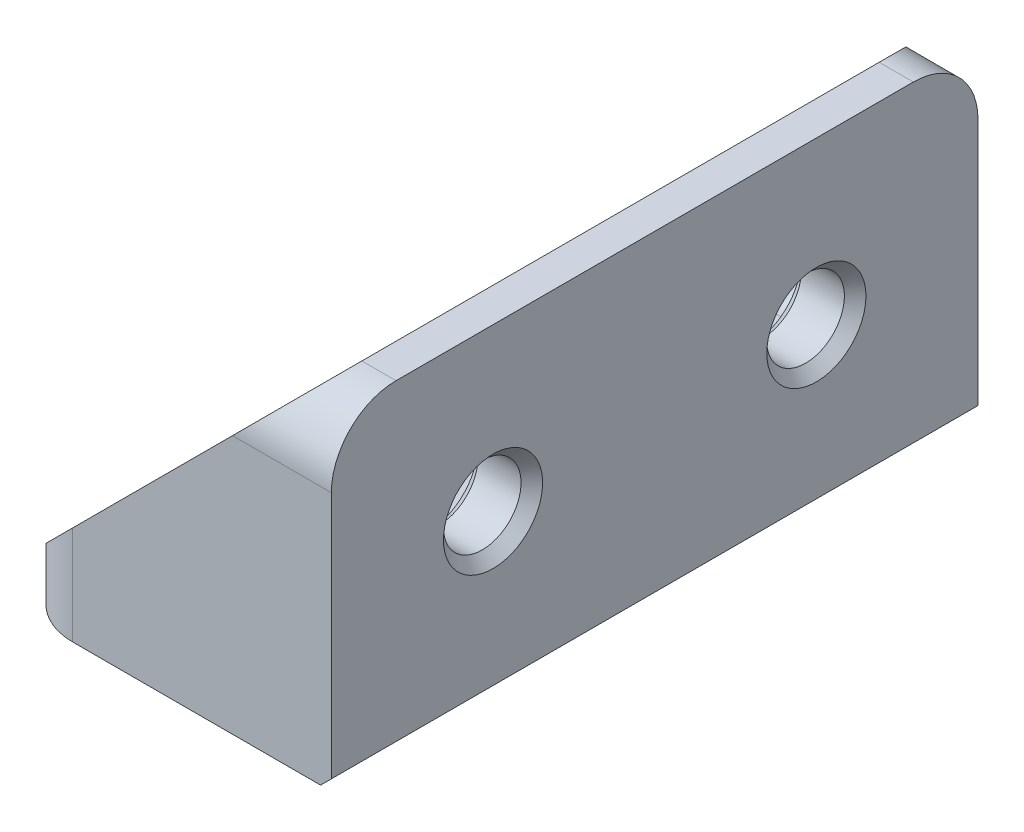
from build123d import *

# Parameters (mm, degrees)
BOSS_EXTRUDE1_DEPTH = 30
CUT_EXTRUDE1_START  = -2.5
CUT_EXTRUDE1_DEPTH  = 25
SKETCH4_R           = 1.8
CUT_EXTRUDE2_DEPTH  = 25
FILLET1_R           = 1
FILLET2_R           = 3
SKETCH5_R           = 2
CUT_EXTRUDE3_DEPTH  = 25
CUT_EXTRUDE4_DEPTH  = 37.742346142
CHAMFER1_SIZE       = 0.5


with BuildPart() as part:
    # Sketch1 → Boss-Extrude1 (new body)
    with BuildSketch(Plane.XY):
        Polygon((0, 0), (0, 15), (-3, 15), (-15, 3), (-15, 0), align=None)
    extrude(amount=BOSS_EXTRUDE1_DEPTH)

    # Sketch3 → Cut-Extrude1 (cut)
    with BuildSketch(Plane.XY.offset(30).offset(CUT_EXTRUDE1_START)):
        Polygon((-15, 3), (-3, 3), (-3, 15), align=None)
    extrude(amount=-CUT_EXTRUDE1_DEPTH, mode=Mode.SUBTRACT)

    # Sketch4 → Cut-Extrude2 (cut)
    with BuildSketch(Plane.ZY.offset(3)):
        with Locations((7.5, 7.5)):
            Circle(SKETCH4_R)
        with Locations((22.5, 7.5)):
            Circle(SKETCH4_R)
    extrude(amount=-CUT_EXTRUDE2_DEPTH, mode=Mode.SUBTRACT)

    # Fillet1
    fillet1_edges = [part.edges().sort_by_distance(p)[0] for p in [
        (-3, 9, 2.5),
        (-9, 3, 2.5),
        (-3, 3, 15),
        (-9, 3, 27.5),
        (-3, 9, 27.5),
    ]]
    fillet(fillet1_edges, radius=FILLET1_R)

    # Fillet2
    fillet2_edges = [part.edges().sort_by_distance(p)[0] for p in [
        (-1.5, 15, 30),
        (-15, 1.5, 30),
        (-15, 1.5, 0),
        (-1.5, 15, 0),
    ]]
    fillet(fillet2_edges, radius=FILLET2_R)

    # Sketch5 → Cut-Extrude3 (cut)
    with BuildSketch(Plane(origin=(0, 3, 0), x_dir=(1, 0, 0), z_dir=(0, 1, 0))):
        with Locations(Location((-10, -15, 0), (0, 0, 270))):
            Circle(SKETCH5_R)
    extrude(amount=-CUT_EXTRUDE3_DEPTH, mode=Mode.SUBTRACT)

    # Sketch6 → Cut-Extrude4 (cut, through all)
    with BuildSketch(Plane(origin=(0, 0, 0), x_dir=(-1, 0, 0), z_dir=(0, 0, -1))):
        Polygon((-1.604036942, 18.18982338), (17.835092671, -1.249306233), (19.956413015, 0.87201411), (-1.074092092, 21.902519217), align=None)
    extrude(amount=-CUT_EXTRUDE4_DEPTH, mode=Mode.SUBTRACT)

    # Chamfer1
    chamfer1_edges = [part.edges().sort_by_distance(p)[0] for p in [
        (0, 7.5, 5.7),
        (-3, 7.5, 5.7),
        (0, 7.5, 20.7),
        (-3, 7.5, 20.7),
        (-10, 0, 13),
        (-10, 3, 13),
        (0, 0, 15),
    ]]
    chamfer(chamfer1_edges, length=CHAMFER1_SIZE)


solid = part.part
